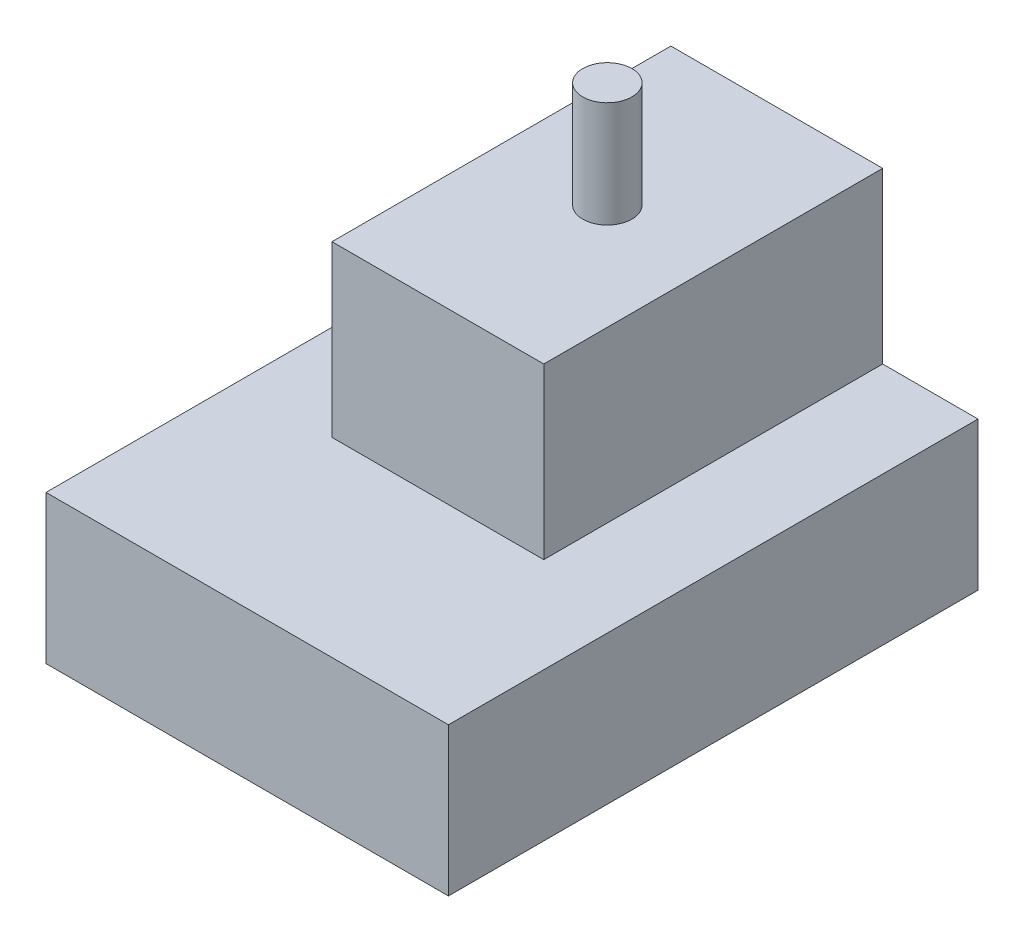
from build123d import *

# Parameters (mm, degrees)
SKETCH1_W           = 12.065
SKETCH1_H           = 9.525
BASE_DEPTH          = 15.875
SKETCH7_W           = 18.144441676
SKETCH7_H           = 22.667604572
SKETCH7_W_2         = 6.35
SKETCH7_H_2         = 10.16
CUT_EXTRUDE1_DEPTH  = 5.08
SKETCH8_R           = 0.7366
BOSS_EXTRUDE1_DEPTH = 3.175


with BuildPart() as part:
    # Sketch1 → Base (new body)
    with BuildSketch(Plane.XY):
        Rectangle(SKETCH1_W, SKETCH1_H)
    extrude(amount=BASE_DEPTH)

    # Sketch7 → Cut-Extrude1 (cut)
    with BuildSketch(Plane(origin=(0, 4.7625, 0), x_dir=(1, 0, 0), z_dir=(0, 1, 0))):
        with Locations((0.669483701, -7.615912702)):
            Rectangle(SKETCH7_W, SKETCH7_H)
        with Locations((0, -5.08)):
            Rectangle(SKETCH7_W_2, SKETCH7_H_2, mode=Mode.SUBTRACT)
    extrude(amount=-CUT_EXTRUDE1_DEPTH, mode=Mode.SUBTRACT)


with BuildPart() as body_2:
    # Sketch8 → Boss-Extrude1 (new body)
    with BuildSketch(Plane(origin=(0, 4.7625, 0), x_dir=(1, 0, 0), z_dir=(0, 1, 0))):
        with Locations(Location((0, -5.08, 0), (0, 0, 270))):
            Circle(SKETCH8_R)
    extrude(amount=BOSS_EXTRUDE1_DEPTH)


solid = Compound([part.part, body_2.part])
